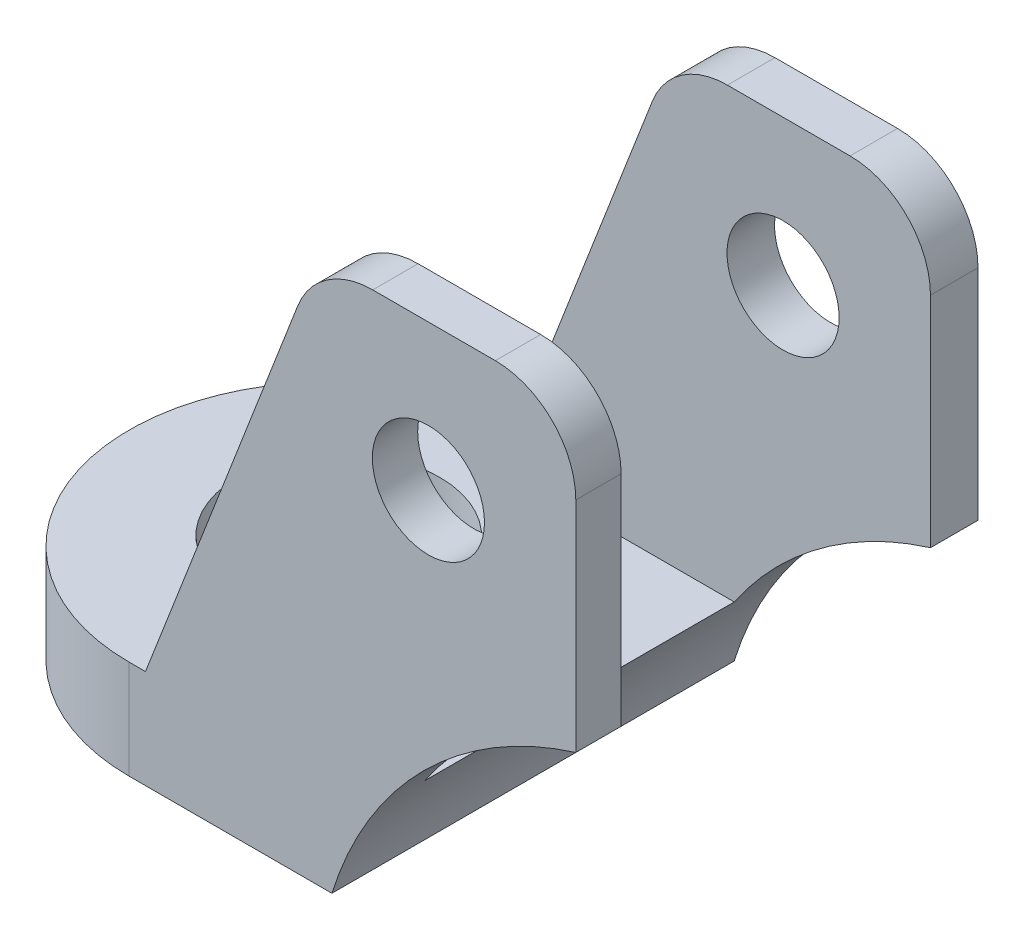
from build123d import *

# Parameters (mm, degrees)
SKETCH2_R           = 6.96865511
BOSS_EXTRUDE1_DEPTH = 25
SKETCH3_W           = 38.455930717
SKETCH3_H           = 55.217032342
CUT_EXTRUDE1_DEPTH  = 109.000086758
FILLET1_RADIUS      = 25
FILLET1_LENGTH      = 12.285129205
FILLET2_R           = 10
FILLET3_R           = 10
FILLET4_R           = 10
FILLET5_R           = 10


with BuildPart() as part:
    # Sketch2 → Boss-Extrude1 (new, symmetric)
    with BuildSketch(Plane.XY):
        with BuildLine():
            Line((0, 0), (50.197302129, 0))
            ThreePointArc((50.197302129, 0), (61.607367951, 18.906462701), (80.513830652, 30.316528523))
            Line((80.513830652, 30.316528523), (80.513830652, 67.502161547))
            Line((80.513830652, 67.502161547), (48.421245481, 67.502161547))
            Line((48.421245481, 67.502161547), (27.021342994, 12.285129205))
            Line((27.021342994, 12.285129205), (0, 12.285129205))
            Line((0, 12.285129205), (0, 0))
        make_face()
        with Locations((62.192399066, 49.399617147)):
            Circle(SKETCH2_R, mode=Mode.SUBTRACT)
    extrude(amount=BOSS_EXTRUDE1_DEPTH, both=True)

    # Sketch3 → Cut-Extrude1 (cut, through all)
    with BuildSketch(Plane(origin=(0, 0, 0), x_dir=(0, 0, -1), z_dir=(1, 0, 0))):
        with Locations((-0.137670396, 39.893645376)):
            Rectangle(SKETCH3_W, SKETCH3_H)
    extrude(amount=CUT_EXTRUDE1_DEPTH, mode=Mode.SUBTRACT)

    # Fillet1: full round fillet: the end face becomes a half cylinder, R = half its width
    fillet1_face = Plane((0, 6.142564603, 0), x_dir=(0, -1, 0), z_dir=(-1, 0, 0))  # on the end face: x along it, z out of the body
    fillet1_slab = fillet1_face.offset(-FILLET1_RADIUS / 2) * Box(FILLET1_LENGTH, 2 * FILLET1_RADIUS, FILLET1_RADIUS, mode=Mode.PRIVATE)  # the body's end, R deep
    fillet1_round = Plane((25, 6.142564603, 0), x_dir=(-1, 0, 0), z_dir=(0, -1, 0)) * Cylinder(FILLET1_RADIUS, FILLET1_LENGTH, mode=Mode.PRIVATE)  # its axis R under the face
    add(fillet1_slab - fillet1_round, mode=Mode.SUBTRACT)

    # Fillet2
    fillet2_edges = [part.edges().sort_by_distance(p)[0] for p in [
        (48.421245481, 67.502161547, -22.045147481),
    ]]
    fillet(fillet2_edges, radius=FILLET2_R)

    # Fillet3
    fillet3_edges = [part.edges().sort_by_distance(p)[0] for p in [
        (80.513830652, 67.502161547, -22.045147481),
    ]]
    fillet(fillet3_edges, radius=FILLET3_R)

    # Fillet4
    fillet4_edges = [part.edges().sort_by_distance(p)[0] for p in [
        (48.421245481, 67.502161547, 22.182817878),
    ]]
    fillet(fillet4_edges, radius=FILLET4_R)

    # Fillet5
    fillet5_edges = [part.edges().sort_by_distance(p)[0] for p in [
        (80.513830652, 67.502161547, 22.182817878),
    ]]
    fillet(fillet5_edges, radius=FILLET5_R)

    # Sketch6 → 3/4 NPT Tapped Hole1 (revolve, cut)
    with BuildSketch(Plane(origin=(24.396705522, 12.285129205, -1.643830205), x_dir=(0, 0, 1), z_dir=(1, 0, 0))):
        Polygon((0, 0), (0, 12.285129205), (11.5062, 12.285129205), (11.5062, 14.05), (12.137858885, 14.05), (12.5585347, 0), align=None)
    revolve(axis=Axis((24.396705522, 18.635129205, -1.643830205), (0, -1, 0)), mode=Mode.SUBTRACT)


solid = part.part
